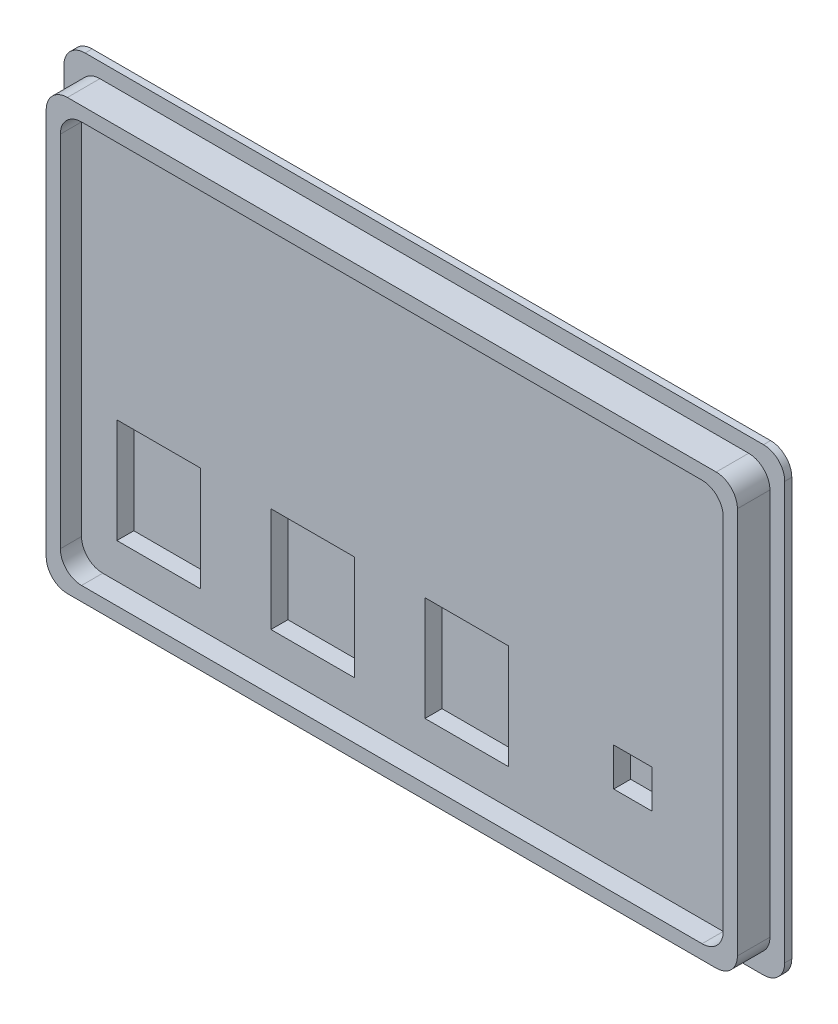
from build123d import *

# Parameters (mm, degrees)
SKICA1_W                = 97.8
SKICA1_H                = 60.8
SKICA1_W_2              = 11.8
SKICA1_H_2              = 14.8
SKICA1_W_3              = 5.4
SKICA1_H_3              = 5.4
P_IDAT_VYSUNUT_M1_DEPTH = 2.6
SKICA1_3_W              = 102
SKICA1_3_H              = 65
SKICA1_3_W_2            = 97.8
SKICA1_3_H_2            = 60.8
P_IDAT_VYSUNUT_M2_DEPTH = 1
SKICA1_5_W              = 11.8
SKICA1_5_H              = 14.8
SKICA1_5_W_2            = 5.4
SKICA1_5_H_2            = 5.4
P_IDAT_VYSUNUT_M3_DEPTH = 0.2
ZAOBLIT1_R              = 3
ZAOBLIT2_R              = 3
SKICA1_6_W              = 97.8
SKICA1_6_H              = 60.8
SKICA1_6_W_2            = 93.8
SKICA1_6_H_2            = 56.8
P_IDAT_VYSUNUT_M4_DEPTH = 5.6
ZAOBLIT4_R              = 3
ZAOBLIT5_R              = 3


with BuildPart() as part:
    # Skica1 → Přidat vysunutím1 (new body)
    with BuildSketch(Plane.XY):
        with Locations((51, 32.5)):
            Rectangle(SKICA1_W, SKICA1_H)
        with Locations((15, 16.5)):
            Rectangle(SKICA1_W_2, SKICA1_H_2, mode=Mode.SUBTRACT)
        with Locations((36.8, 16.5)):
            Rectangle(SKICA1_W_2, SKICA1_H_2, mode=Mode.SUBTRACT)
        with Locations((58.6, 16.5)):
            Rectangle(SKICA1_W_2, SKICA1_H_2, mode=Mode.SUBTRACT)
        with Locations((82.1, 16.5)):
            Rectangle(SKICA1_W_3, SKICA1_H_3, mode=Mode.SUBTRACT)
    extrude(amount=P_IDAT_VYSUNUT_M1_DEPTH)

    # Skica1<3> → Přidat vysunutím2 (add)
    with BuildSketch(Plane.XY):
        with Locations((51, 32.5)):
            Rectangle(SKICA1_3_W, SKICA1_3_H)
        with Locations((51, 32.5)):
            Rectangle(SKICA1_3_W_2, SKICA1_3_H_2, mode=Mode.SUBTRACT)
    extrude(amount=P_IDAT_VYSUNUT_M2_DEPTH)

    # Skica1<5> → Přidat vysunutím3 (add)
    with BuildSketch(Plane.XY):
        with Locations((58.6, 16.5)):
            Rectangle(SKICA1_5_W, SKICA1_5_H)
        with Locations((15, 16.5)):
            Rectangle(SKICA1_5_W, SKICA1_5_H)
        with Locations((36.8, 16.5)):
            Rectangle(SKICA1_5_W, SKICA1_5_H)
        with Locations((82.1, 16.5)):
            Rectangle(SKICA1_5_W_2, SKICA1_5_H_2)
    extrude(amount=P_IDAT_VYSUNUT_M3_DEPTH)

    # Zaoblit1
    zaoblit1_edges = [part.edges().sort_by_distance(p)[0] for p in [
        (0, 0, 0.5),
        (102, 0, 0.5),
        (102, 65, 0.5),
        (0, 65, 0.5),
    ]]
    fillet(zaoblit1_edges, radius=ZAOBLIT1_R)

    # Zaoblit2
    zaoblit2_edges = [part.edges().sort_by_distance(p)[0] for p in [
        (99.9, 2.1, 1.8),
        (99.9, 62.9, 1.8),
        (2.1, 62.9, 1.8),
        (2.1, 2.1, 1.8),
    ]]
    fillet(zaoblit2_edges, radius=ZAOBLIT2_R)

    # Skica1<6> → Přidat vysunutím4 (add)
    with BuildSketch(Plane.XY):
        with Locations((51, 32.5)):
            Rectangle(SKICA1_6_W, SKICA1_6_H)
        with Locations((51, 32.5)):
            Rectangle(SKICA1_6_W_2, SKICA1_6_H_2, mode=Mode.SUBTRACT)
    extrude(amount=P_IDAT_VYSUNUT_M4_DEPTH)

    # Zaoblit4
    zaoblit4_edges = [part.edges().sort_by_distance(p)[0] for p in [
        (2.1, 62.9, 3.3),
        (99.9, 2.1, 3.3),
        (2.1, 2.1, 3.3),
        (99.9, 62.9, 3.3),
    ]]
    fillet(zaoblit4_edges, radius=ZAOBLIT4_R)

    # Zaoblit5
    zaoblit5_edges = [part.edges().sort_by_distance(p)[0] for p in [
        (4.1, 60.9, 4.1),
        (97.9, 60.9, 4.1),
        (97.9, 4.1, 4.1),
        (4.1, 4.1, 4.1),
    ]]
    fillet(zaoblit5_edges, radius=ZAOBLIT5_R)


solid = part.part
